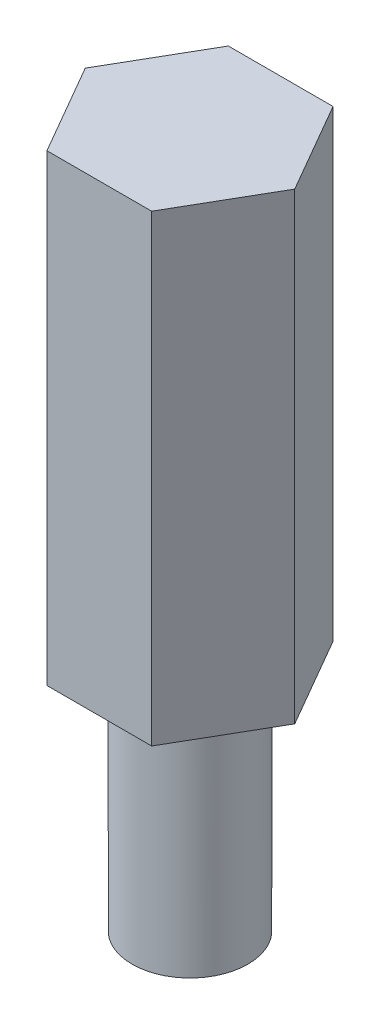
from build123d import *

# Parameters (mm, degrees)
EXTRUDE_1_DEPTH = 12
SKETCH_2_R      = 1.5
EXTRUDE_2_DEPTH = 6


with BuildPart() as part:
    # 草图1 → 凸台-拉伸1 (new body)
    with BuildSketch(Plane(origin=(0, 0, 0), x_dir=(1, 0, 0), z_dir=(0, 1, 0))):
        Polygon((-1.356773133, 2.35), (-2.713546265, 0), (-1.356773133, -2.35), (1.356773133, -2.35), (2.713546265, 0), (1.356773133, 2.35), align=None)
    extrude(amount=EXTRUDE_1_DEPTH)

    # 草图2 → 凸台-拉伸2 (add)
    with BuildSketch(Plane.XZ):
        with Locations(Location((0, 0, 0), (0, 0, 90))):
            Circle(SKETCH_2_R)
    extrude(amount=EXTRUDE_2_DEPTH)


solid = part.part
